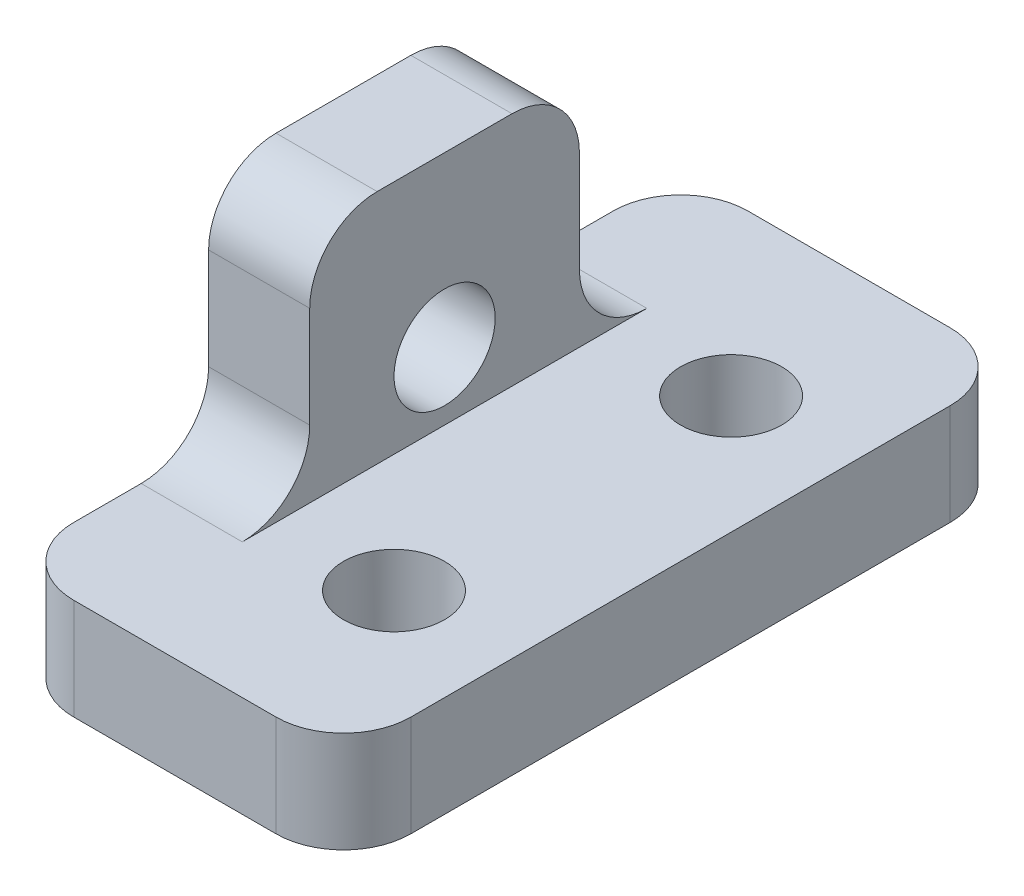
from build123d import *

# Parameters (mm, degrees)
SKETCH1_R           = 1.5
BOSS_EXTRUDE1_DEPTH = 3
SKETCH2_W           = 20
SKETCH2_H           = 3
BOSS_EXTRUDE2_DEPTH = 7
SKETCH3_R           = 1.5
CUT_EXTRUDE1_DEPTH  = 12.5
FILLET1_R           = 2


with BuildPart() as part:
    # Sketch1 → Boss-Extrude1 (new body)
    with BuildSketch(Plane(origin=(0, 0, 0), x_dir=(0, 0, -1), z_dir=(1, 0, 0))):
        Polygon((14, 10), (14, 3), (20, 3), (20, 0), (0, 0), (0, 3), (6, 3), (6, 10), align=None)
        with Locations((10, 5)):
            Circle(SKETCH1_R, mode=Mode.SUBTRACT)
    extrude(amount=BOSS_EXTRUDE1_DEPTH)

    # Sketch2 → Boss-Extrude2 (add)
    with BuildSketch(Plane(origin=(3, 0, 0), x_dir=(0, 0, -1), z_dir=(1, 0, 0))):
        with Locations((10, 1.5)):
            Rectangle(SKETCH2_W, SKETCH2_H)
    extrude(amount=BOSS_EXTRUDE2_DEPTH)

    # Sketch3 → Cut-Extrude1 (cut, symmetric)
    with BuildSketch(Plane(origin=(0, 3, 0), x_dir=(1, 0, 0), z_dir=(0, 1, 0))):
        with Locations(Location((6.5, 15, 0), (0, 0, 270))):
            Circle(SKETCH3_R)
        with Locations(Location((6.5, 5, 0), (0, 0, 270))):
            Circle(SKETCH3_R)
    extrude(amount=CUT_EXTRUDE1_DEPTH, both=True, mode=Mode.SUBTRACT)

    # Fillet1
    fillet1_edges = [part.edges().sort_by_distance(p)[0] for p in [
        (0, 1.5, -20),
        (0, 1.5, 0),
        (1.5, 3, -6),
        (1.5, 10, -6),
        (1.5, 10, -14),
        (1.5, 3, -14),
        (10, 1.5, 0),
        (10, 1.5, -20),
    ]]
    fillet(fillet1_edges, radius=FILLET1_R)


solid = part.part
